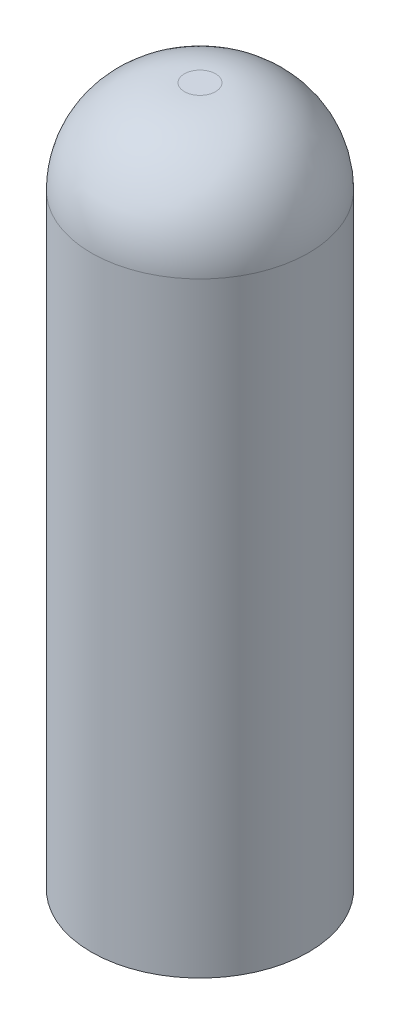
from build123d import *

# Parameters (mm, degrees)
SKETCH1_R           = 7
BOSS_EXTRUDE1_DEPTH = 45
FILLET1_R           = 6
SKETCH2_R           = 2.05
CUT_EXTRUDE1_DEPTH  = 6


with BuildPart() as part:
    # Sketch1 → Boss-Extrude1 (new body)
    with BuildSketch(Plane(origin=(0, 0, 0), x_dir=(1, 0, 0), z_dir=(0, 1, 0))):
        with Locations(Location((0, 0, 0), (0, 0, 90))):
            Circle(SKETCH1_R)
    extrude(amount=BOSS_EXTRUDE1_DEPTH)

    # Fillet1
    fillet1_edges = [part.edges().sort_by_distance(p)[0] for p in [
        (0, 45, 7),
    ]]
    fillet(fillet1_edges, radius=FILLET1_R)

    # Sketch2 → Cut-Extrude1 (cut)
    with BuildSketch(Plane.XZ):
        with Locations(Location((0, 0, 0), (0, 0, 270))):
            Circle(SKETCH2_R)
    extrude(amount=-CUT_EXTRUDE1_DEPTH, mode=Mode.SUBTRACT)


solid = part.part
